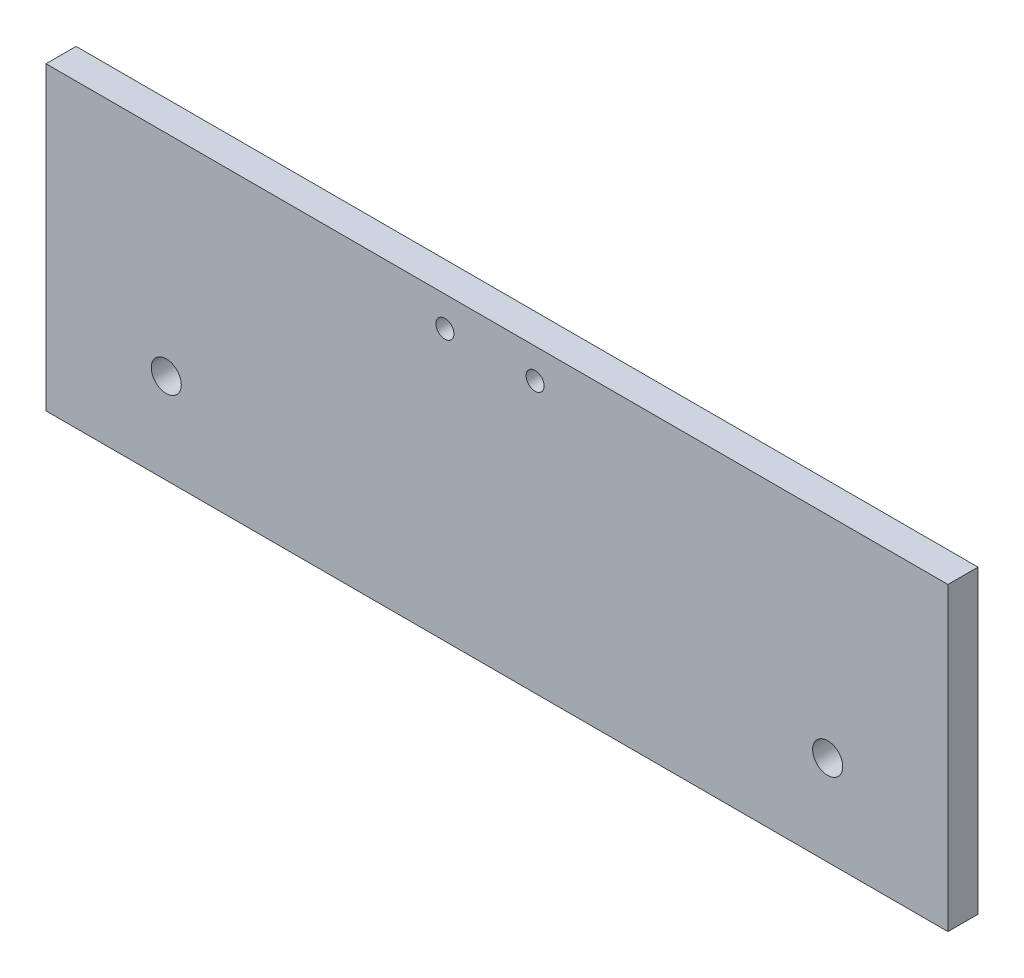
from build123d import *

# Parameters (mm, degrees)
ESQUISSE1_W             = 300
ESQUISSE1_H             = 100
BOSS_EXTRU_1_DEPTH      = 10
ESQUISSE2_R             = 3
ENL_V_MAT_EXTRU_1_DEPTH = 212.887970305
ESQUISSE3_R             = 5
ENL_V_MAT_EXTRU_2_DEPTH = 212.887970305


with BuildPart() as part:
    # Esquisse1 → Boss.-Extru.1 (new body)
    with BuildSketch(Plane.XY):
        with Locations((36.538231899, 50)):
            Rectangle(ESQUISSE1_W, ESQUISSE1_H)
    extrude(amount=BOSS_EXTRU_1_DEPTH)

    # Esquisse2 → Enlèv. mat.-Extru.1 (cut, through all)
    with BuildSketch(Plane.XY.offset(10)):
        with Locations((49.22419633, 90)):
            Circle(ESQUISSE2_R)
        with Locations((19.22419633, 90)):
            Circle(ESQUISSE2_R)
    extrude(amount=-ENL_V_MAT_EXTRU_1_DEPTH, mode=Mode.SUBTRACT)

    # Esquisse3 → Enlèv. mat.-Extru.2 (cut, through all)
    with BuildSketch(Plane.XY.offset(10)):
        with Locations((-73.461768101, 30)):
            Circle(ESQUISSE3_R)
        with Locations((146.538231899, 30)):
            Circle(ESQUISSE3_R)
    extrude(amount=-ENL_V_MAT_EXTRU_2_DEPTH, mode=Mode.SUBTRACT)


solid = part.part
